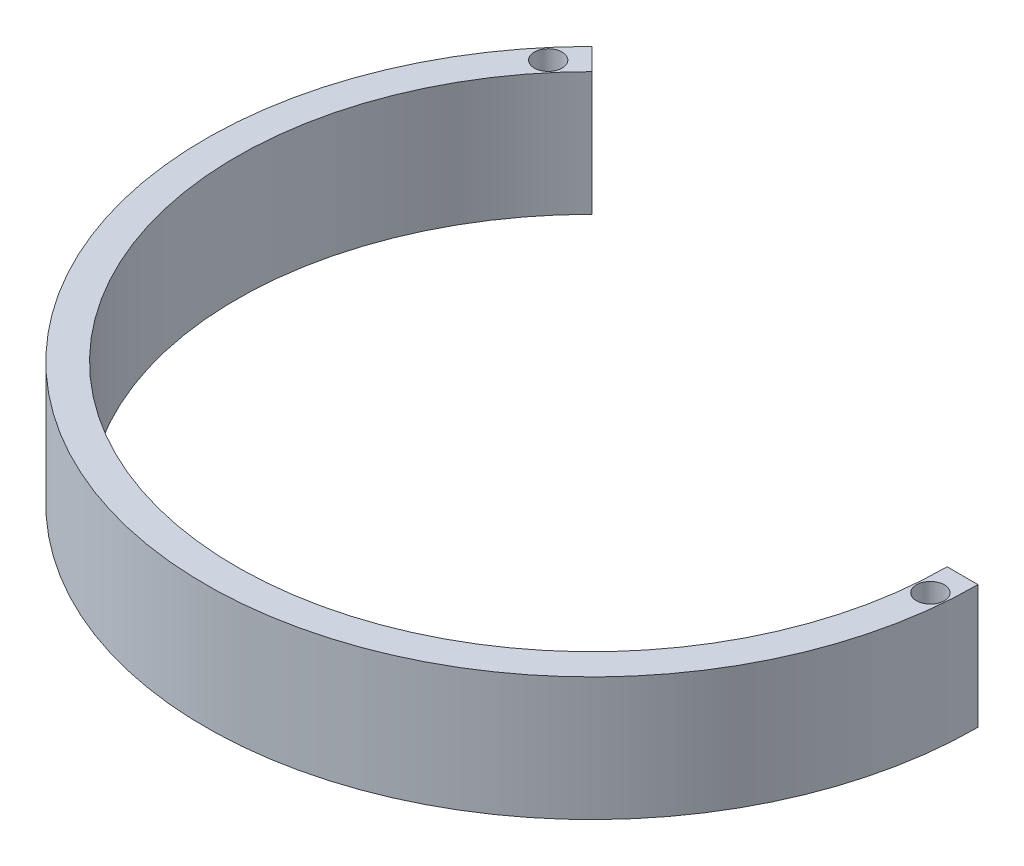
from build123d import *

# Parameters (mm, degrees)
SKETCH2_W            = 20
SKETCH2_H            = 5
M4_CLEARANCE_HOLE1_D = 4.5


with BuildPart() as part:
    # Sweep1: sweep along a path in Sketch1
    with BuildLine(Plane(origin=(0, 0, 0), x_dir=(1, 0, 0), z_dir=(0, 1, 0))) as sweep1_path:
        ThreePointArc((-42.426406871, 42.426406871), (-22.961005942, -55.432771951), (60, 0))
    # Sketch2 → Sweep1 (sweep)
    with BuildSketch(Plane(origin=(0, 0, 0), x_dir=(0, 1, 0), z_dir=(0, 0, 1))):
        with Locations((0, 60)):
            Rectangle(SKETCH2_W, SKETCH2_H)
    sweep(path=sweep1_path.line)

    # M4 Clearance Hole1 (through all)
    with Locations(Plane(origin=(0, -10, 0), x_dir=(-1, 0, 0), z_dir=(0, -1, 0))):
        with Locations((-59.791303716, -5), (45.814370219, 38.743302407)):
            Hole(M4_CLEARANCE_HOLE1_D / 2)


solid = part.part
